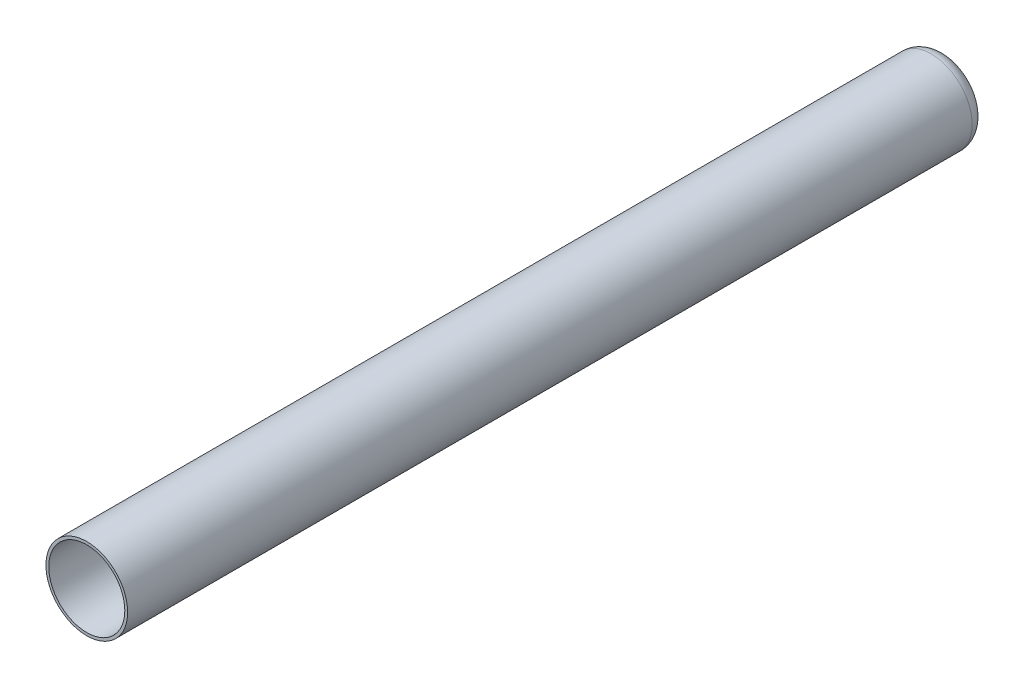
from build123d import *

# Parameters (mm, degrees)
SKETCH1_R           = 14.5
BOSS_EXTRUDE1_DEPTH = 304.8
SKETCH2_R           = 13.5
CUT_EXTRUDE1_DEPTH  = 301
FILLET2_R           = 5
SKETCH8_R           = 9.5
CUT_EXTRUDE2_DEPTH  = 10


with BuildPart() as part:
    # Sketch1 → Boss-Extrude1 (new body)
    with BuildSketch(Plane.XY):
        Circle(SKETCH1_R)
    extrude(amount=-BOSS_EXTRUDE1_DEPTH)

    # Sketch2 → Cut-Extrude1 (cut)
    with BuildSketch(Plane.XY):
        Circle(SKETCH2_R)
    extrude(amount=-CUT_EXTRUDE1_DEPTH, mode=Mode.SUBTRACT)

    # Fillet2
    fillet2_edges = [part.edges().sort_by_distance(p)[0] for p in [
        (-14.5, 0, -304.8),
    ]]
    fillet(fillet2_edges, radius=FILLET2_R)

    # Sketch8 → Cut-Extrude2 (cut)
    with BuildSketch(Plane(origin=(0, 0, -304.8), x_dir=(-1, 0, 0), z_dir=(0, 0, -1))):
        with Locations(Location((0, 0, 0), (0, 0, 180))):
            Circle(SKETCH8_R)
    extrude(amount=-CUT_EXTRUDE2_DEPTH, mode=Mode.SUBTRACT)


solid = part.part
